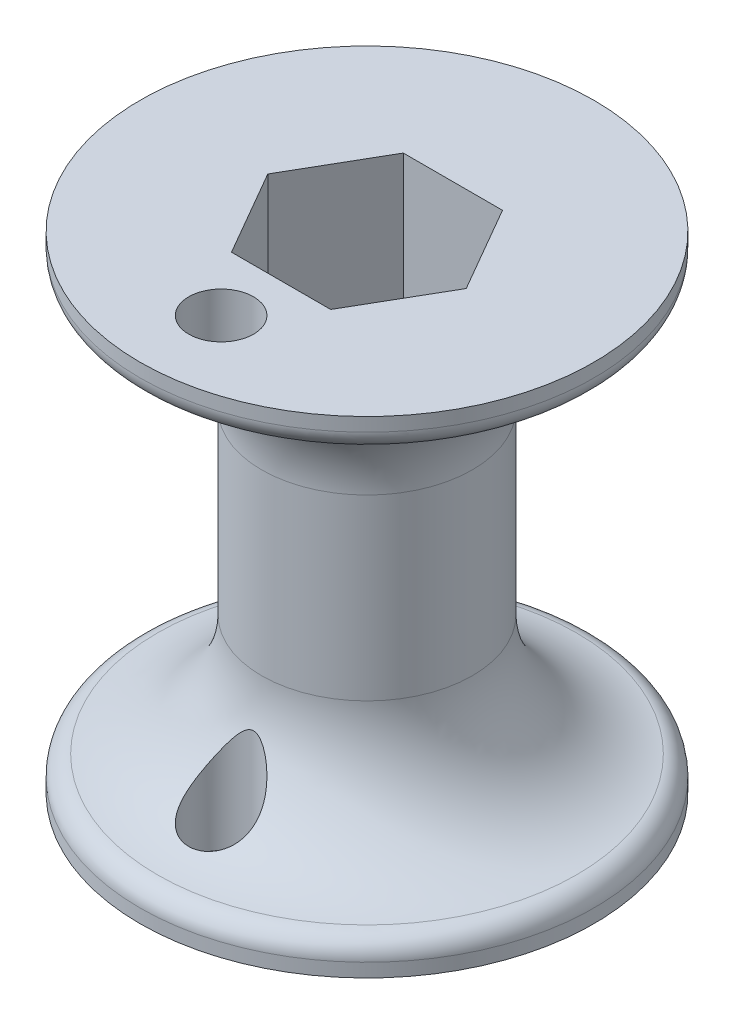
from build123d import *

# Parameters (mm, degrees)
SKETCH2_R          = 2.54
CUT_EXTRUDE1_DEPTH = 46.649389919
FILLET1_R          = 1.5875


with BuildPart() as part:
    # Sketch1 → Revolve1 (revolve)
    with BuildSketch(Plane(origin=(0, 0, 0), x_dir=(0, 0, -1), z_dir=(1, 0, 0))):
        with BuildLine():
            Line((0, 0), (0, 19.05))
            Line((0, 19.05), (17.78, 19.05))
            Line((17.78, 19.05), (17.78, 16.51))
            ThreePointArc((17.78, 16.51), (11.044807909, 13.720192091), (8.255, 6.985))
            Line((8.255, 6.985), (8.255, 0))
            Line((8.255, 0), (0, 0))
        make_face()
    revolve1 = revolve(axis=Axis((0, 0, 0), (0, 1, 0)))

    # Mirror1: Revolve1 across plane
    add(revolve1.mirror(Plane(origin=(0, 0, -8.255), x_dir=(0, 0, 1), z_dir=(0, -1, 0))))

    # Sketch2 → Cut-Extrude1 (cut, through all)
    with BuildSketch(Plane(origin=(0, 19.05, 0), x_dir=(1, 0, 0), z_dir=(0, 1, 0))):
        with Locations(Location((0, -11.43, 0), (0, 0, 270))):
            Circle(SKETCH2_R)
        Polygon((-3.886144662, -6.731), (3.886144662, -6.731), (7.772289324, 0), (3.886144662, 6.731), (-3.886144662, 6.731), (-7.772289324, 0), align=None)
    extrude(amount=-CUT_EXTRUDE1_DEPTH, mode=Mode.SUBTRACT)

    # Fillet1
    fillet1_edges = [part.edges().sort_by_distance(p)[0] for p in [
        (0, -16.51, 17.78),
        (0, 16.51, 17.78),
    ]]
    fillet(fillet1_edges, radius=FILLET1_R)


solid = part.part
